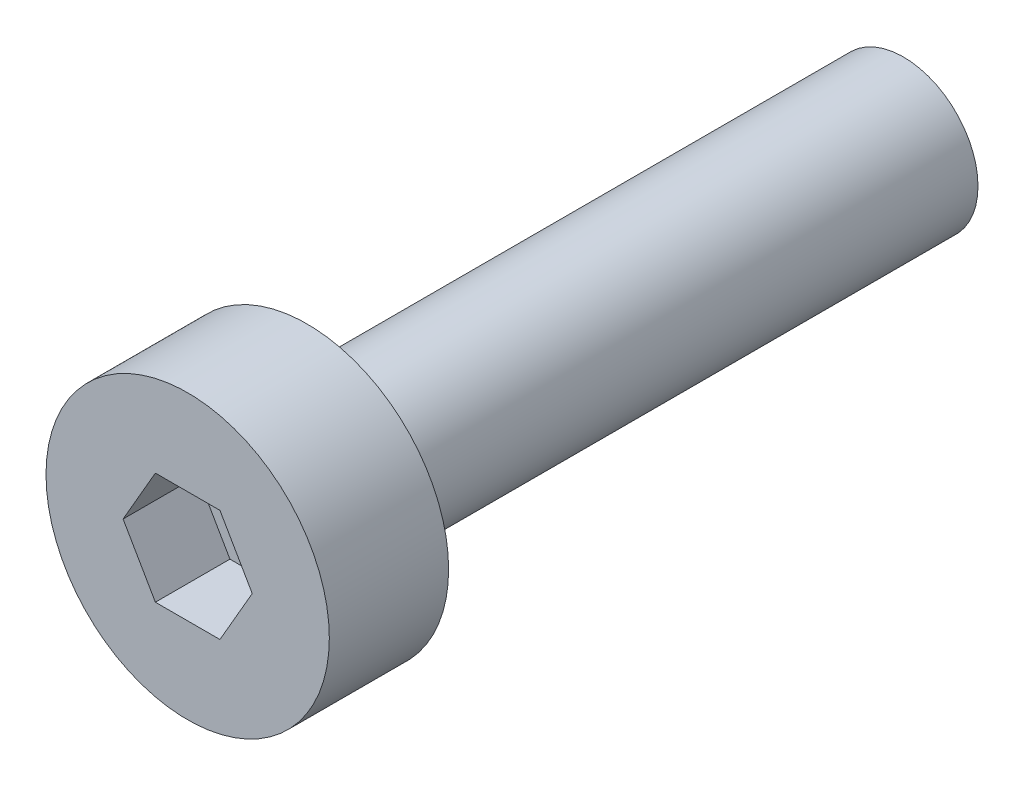
from build123d import *

# Parameters (mm, degrees)
ESQUISSE1_R             = 1
BOSS_EXTRU_1_DEPTH      = 8
ESQUISSE2_R             = 1.9
BOSS_EXTRU_2_DEPTH      = 1.6
ENL_V_MAT_EXTRU_1_DEPTH = 1


with BuildPart() as part:
    # Esquisse1 → Boss.-Extru.1 (new body)
    with BuildSketch(Plane.XY):
        Circle(ESQUISSE1_R)
    extrude(amount=BOSS_EXTRU_1_DEPTH)

    # Esquisse2 → Boss.-Extru.2 (add)
    with BuildSketch(Plane.XY.offset(8)):
        Circle(ESQUISSE2_R)
    extrude(amount=BOSS_EXTRU_2_DEPTH)

    # Esquisse3 → Enlèv. mat.-Extru.1 (cut)
    with BuildSketch(Plane.XY.offset(9.6)):
        Polygon((0.866025404, 0), (0.433012702, 0.75), (-0.433012702, 0.75), (-0.866025404, 0), (-0.433012702, -0.75), (0.433012702, -0.75), align=None)
    extrude(amount=-ENL_V_MAT_EXTRU_1_DEPTH, mode=Mode.SUBTRACT)


solid = part.part
